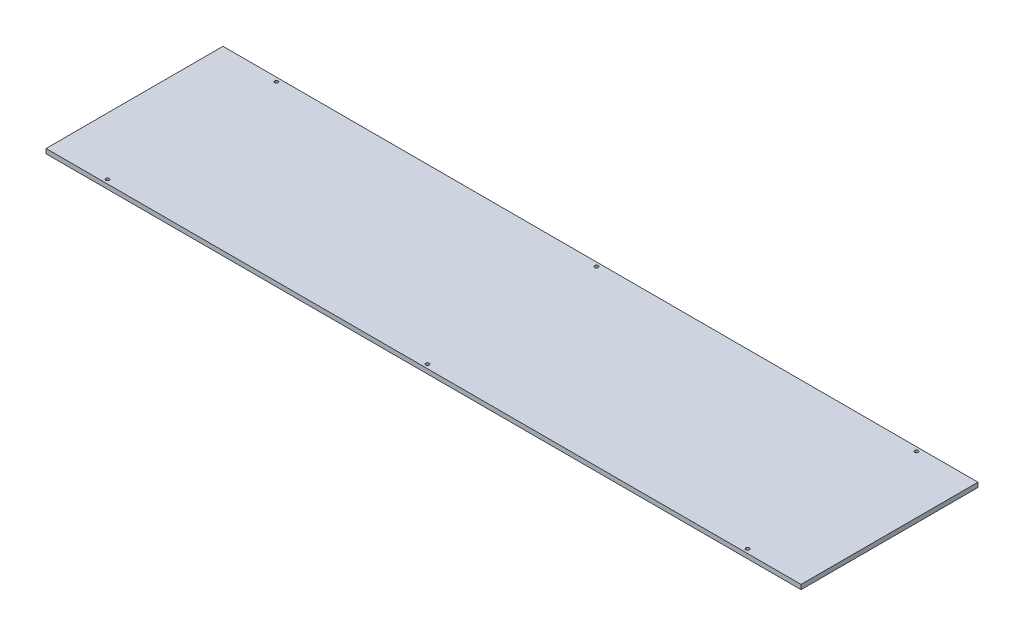
from build123d import *

# Parameters (mm, degrees)
SKETCH1_W           = 657
SKETCH1_H           = 154
SKETCH1_R           = 1.5
BOSS_EXTRUDE3_DEPTH = 4


with BuildPart() as part:
    # Sketch1 → Boss-Extrude3 (new body)
    with BuildSketch(Plane(origin=(0, 0, 0), x_dir=(1, 0, 0), z_dir=(0, 1, 0))):
        with Locations((21.753538462, 2.806461538)):
            Rectangle(SKETCH1_W, SKETCH1_H)
        with Locations(Location((-256.746461538, 76.306461538, 0), (0, 0, 270))):
            Circle(SKETCH1_R, mode=Mode.SUBTRACT)
        with Locations(Location((21.753538462, 76.306461538, 0), (0, 0, 270))):
            Circle(SKETCH1_R, mode=Mode.SUBTRACT)
        with Locations(Location((300.253538462, 76.306461538, 0), (0, 0, 270))):
            Circle(SKETCH1_R, mode=Mode.SUBTRACT)
        with Locations(Location((300.253538462, -70.693538462, 0), (0, 0, 270))):
            Circle(SKETCH1_R, mode=Mode.SUBTRACT)
        with Locations(Location((21.753538462, -70.693538462, 0), (0, 0, 270))):
            Circle(SKETCH1_R, mode=Mode.SUBTRACT)
        with Locations(Location((-256.746461538, -70.693538462, 0), (0, 0, 270))):
            Circle(SKETCH1_R, mode=Mode.SUBTRACT)
    extrude(amount=BOSS_EXTRUDE3_DEPTH)


solid = part.part
